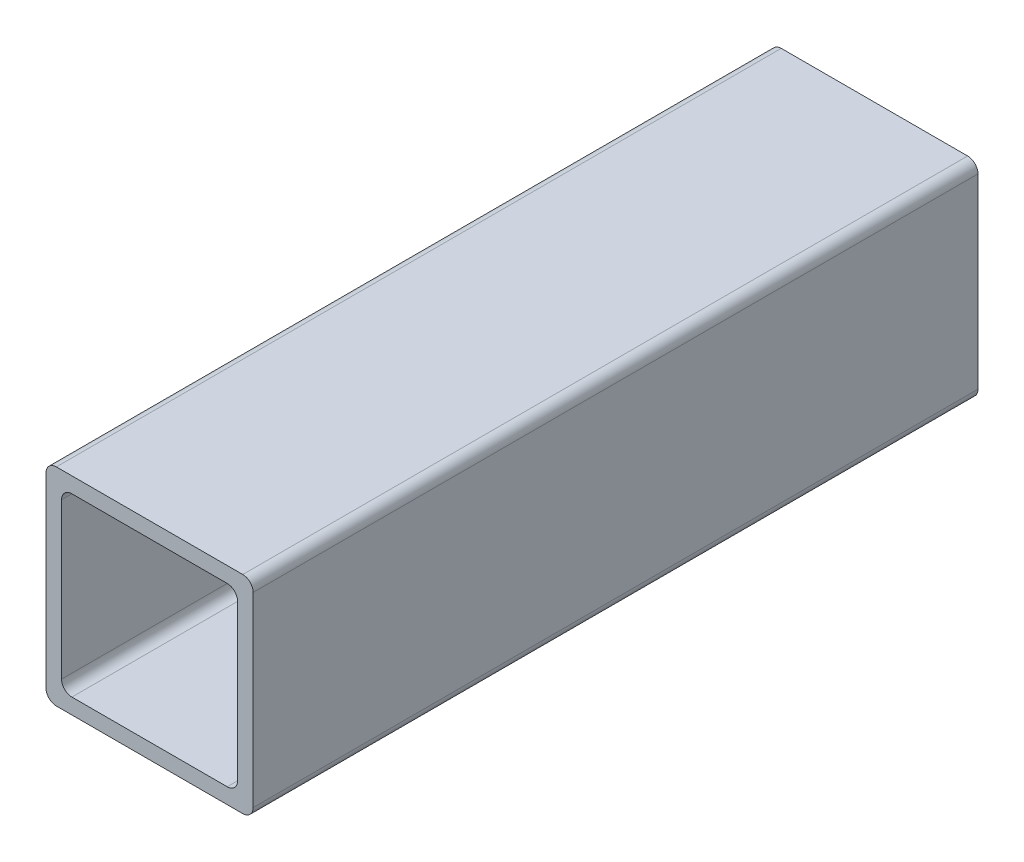
from build123d import *

# Parameters (mm, degrees)
SKETCH1_W           = 40
SKETCH1_H           = 40
BOSS_EXTRUDE1_DEPTH = 140
SKETCH2_W           = 34
SKETCH2_H           = 34
CUT_EXTRUDE1_DEPTH  = 143.828568571
FILLET1_R           = 2
FILLET2_R           = 2


with BuildPart() as part:
    # Sketch1 → Boss-Extrude1 (new body)
    with BuildSketch(Plane.XY):
        Rectangle(SKETCH1_W, SKETCH1_H)
    extrude(amount=BOSS_EXTRUDE1_DEPTH)

    # Sketch2 → Cut-Extrude1 (cut, through all)
    with BuildSketch(Plane.XY.offset(140)):
        Rectangle(SKETCH2_W, SKETCH2_H)
    extrude(amount=-CUT_EXTRUDE1_DEPTH, mode=Mode.SUBTRACT)

    # Fillet1
    fillet1_edges = [part.edges().sort_by_distance(p)[0] for p in [
        (20, -20, 70),
        (-20, -20, 70),
        (-20, 20, 70),
        (20, 20, 70),
    ]]
    fillet(fillet1_edges, radius=FILLET1_R)

    # Fillet2
    fillet2_edges = [part.edges().sort_by_distance(p)[0] for p in [
        (17, 17, 70),
        (17, -17, 70),
        (-17, -17, 70),
        (-17, 17, 70),
    ]]
    fillet(fillet2_edges, radius=FILLET2_R)


solid = part.part
